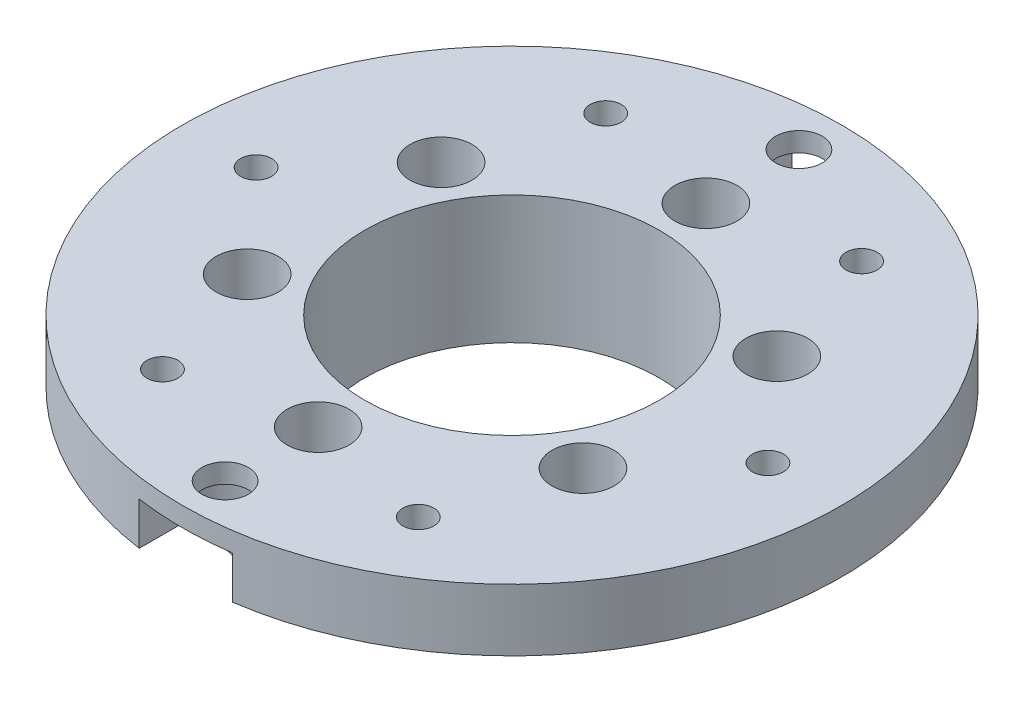
from build123d import *

# Parameters (mm, degrees)
SKETCH1_R           = 21.25
BOSS_EXTRUDE1_DEPTH = 4
SKETCH2_R           = 1.5
CUT_EXTRUDE1_DEPTH  = 4
SKETCH5_R           = 16.5
BOSS_EXTRUDE2_DEPTH = 0.25
SKETCH6_R           = 15.075
BOSS_EXTRUDE3_DEPTH = 4
CHAMFER1_SIZE       = 0.5
SKETCH7_R           = 9.5
CUT_EXTRUDE3_DEPTH  = 8.25
SKETCH8_R           = 1
CUT_EXTRUDE4_DEPTH  = 3
CIRPATTERN2_COUNT   = 6
CUT_EXTRUDE5_DEPTH  = 3
CIRPATTERN3_COUNT   = 2
SKETCH13_R          = 2
CUT_EXTRUDE6_DEPTH  = 6.25
SKETCH14_R          = 1.6
CUT_EXTRUDE7_DEPTH  = 2
CIRPATTERN4_COUNT   = 6


with BuildPart() as part:
    # Sketch1 → Boss-Extrude1 (new body)
    with BuildSketch(Plane(origin=(0, 0, 0), x_dir=(1, 0, 0), z_dir=(0, 1, 0))):
        with Locations(Location((0, 0, 0), (0, 0, 270))):
            Circle(SKETCH1_R)
    extrude(amount=BOSS_EXTRUDE1_DEPTH)

    # Sketch2 → Cut-Extrude1 (cut)
    with BuildSketch(Plane(origin=(0, 4, 0), x_dir=(1, 0, 0), z_dir=(0, 1, 0))):
        with Locations(Location((0, 18.5, 0), (0, 0, 270))):
            Circle(SKETCH2_R)
    cut_extrude1 = extrude(amount=-CUT_EXTRUDE1_DEPTH, mode=Mode.SUBTRACT)

    # Sketch5 → Boss-Extrude2 (add)
    with BuildSketch(Plane.XZ):
        with Locations(Location((0, 0, 0), (0, 0, 90))):
            Circle(SKETCH5_R)
    extrude(amount=BOSS_EXTRUDE2_DEPTH)

    # Sketch6 → Boss-Extrude3 (add)
    with BuildSketch(Plane.XZ.offset(0.25)):
        with Locations(Location((0, 0, 0), (0, 0, 270))):
            Circle(SKETCH6_R)
    extrude(amount=BOSS_EXTRUDE3_DEPTH)

    # Chamfer1
    chamfer1_edges = [part.edges().sort_by_distance(p)[0] for p in [
        (0, -4.25, 15.075),
    ]]
    chamfer(chamfer1_edges, length=CHAMFER1_SIZE)

    # Sketch7 → Cut-Extrude3 (cut)
    with BuildSketch(Plane.XZ.offset(4.25)):
        with Locations(Location((0, 0, 0), (0, 0, 270))):
            Circle(SKETCH7_R)
    extrude(amount=-CUT_EXTRUDE3_DEPTH, mode=Mode.SUBTRACT)

    # Sketch8 → Cut-Extrude4 (cut)
    with BuildSketch(Plane(origin=(0, 4, 0), x_dir=(1, 0, 0), z_dir=(0, 1, 0))):
        with Locations(Location((8.25, 14.289419162, 0), (0, 0, 270))):
            Circle(SKETCH8_R)
    cut_extrude4 = extrude(amount=-CUT_EXTRUDE4_DEPTH, mode=Mode.SUBTRACT)

    # CirPattern2: Cut-Extrude4 ×6 about axis
    cirpattern2_axis = Axis((0, 0, 0), (0, 1, 0))
    for i in range(1, CIRPATTERN2_COUNT):
        add(cut_extrude4.rotate(cirpattern2_axis, i * 360 / CIRPATTERN2_COUNT), mode=Mode.SUBTRACT)

    # Sketch11 → Cut-Extrude5 (cut)
    with BuildSketch(Plane.XZ.offset(0.25)):
        with BuildLine():
            Line((-3, -18.5), (-3, -22.883659788))
            Line((-3, -22.883659788), (3, -22.883659788))
            Line((3, -22.883659788), (3, -18.5))
            ThreePointArc((3, -18.5), (0, -15.5), (-3, -18.5))
        make_face()
    cut_extrude5 = extrude(amount=-CUT_EXTRUDE5_DEPTH, mode=Mode.SUBTRACT)

    # CirPattern3: Cut-Extrude1, Cut-Extrude5 ×2 about axis
    cirpattern3_axis = Axis((0, 0, 0), (0, 1, 0))
    add([cut_extrude1.rotate(cirpattern3_axis, i * 360 / CIRPATTERN3_COUNT) for i in range(1, CIRPATTERN3_COUNT)], mode=Mode.SUBTRACT)
    add([cut_extrude5.rotate(cirpattern3_axis, i * 360 / CIRPATTERN3_COUNT) for i in range(1, CIRPATTERN3_COUNT)], mode=Mode.SUBTRACT)

    # Sketch13 → Cut-Extrude6 (cut)
    with BuildSketch(Plane(origin=(0, 4, 0), x_dir=(1, 0, 0), z_dir=(0, 1, 0))):
        with Locations(Location((0, 12.5, 0), (0, 0, 270))):
            Circle(SKETCH13_R)
    cut_extrude6 = extrude(amount=-CUT_EXTRUDE6_DEPTH, mode=Mode.SUBTRACT)

    # Sketch14 → Cut-Extrude7 (cut)
    with BuildSketch(Plane(origin=(0, -2.25, 0), x_dir=(1, 0, 0), z_dir=(0, 1, 0))):
        with Locations(Location((0, 12.5, 0), (0, 0, 270))):
            Circle(SKETCH14_R)
    cut_extrude7 = extrude(amount=-CUT_EXTRUDE7_DEPTH, mode=Mode.SUBTRACT)

    # CirPattern4: Cut-Extrude6, Cut-Extrude7 ×6 about axis
    cirpattern4_axis = Axis((0, 0, 0), (0, 1, 0))
    add([cut_extrude6.rotate(cirpattern4_axis, i * 360 / CIRPATTERN4_COUNT) for i in range(1, CIRPATTERN4_COUNT)], mode=Mode.SUBTRACT)
    add([cut_extrude7.rotate(cirpattern4_axis, i * 360 / CIRPATTERN4_COUNT) for i in range(1, CIRPATTERN4_COUNT)], mode=Mode.SUBTRACT)


solid = part.part
